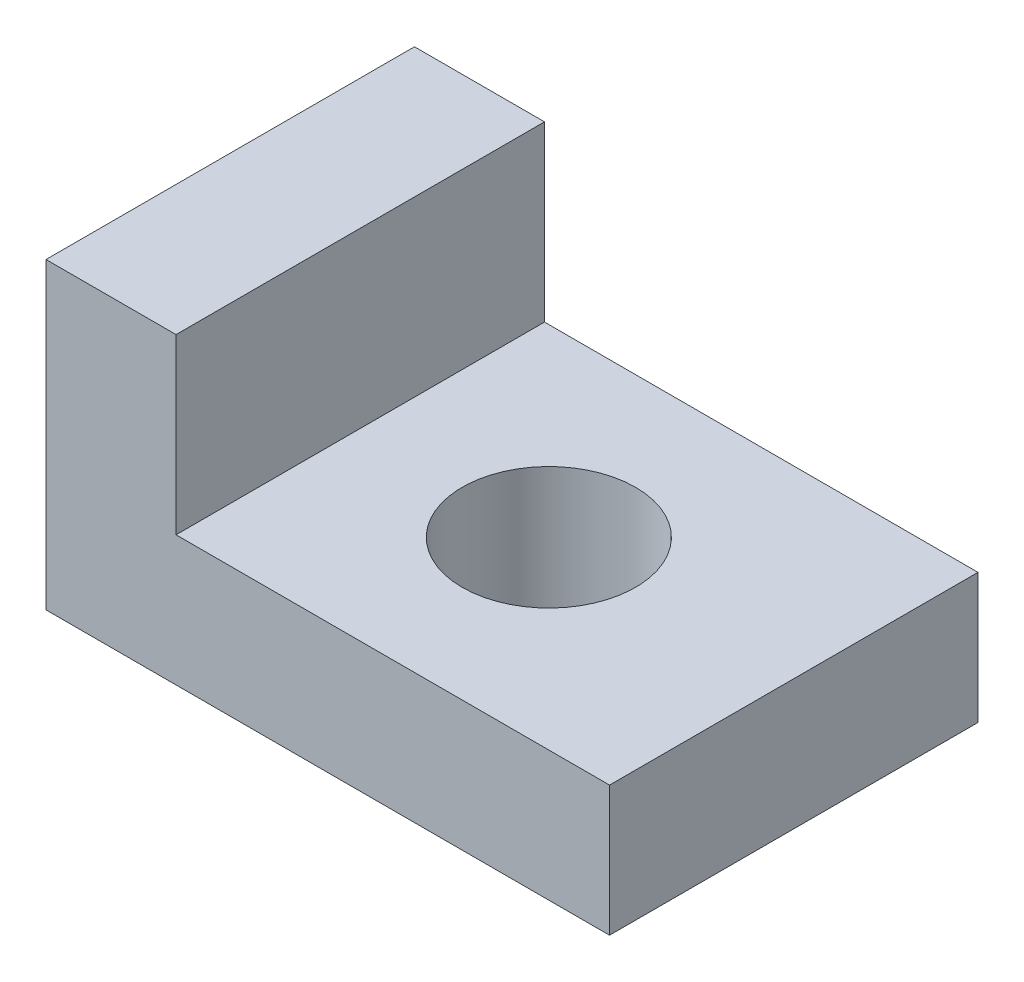
from build123d import *

# Parameters (mm, degrees)
SKETCH1_W           = 13
SKETCH1_H           = 8.5
BOSS_EXTRUDE2_DEPTH = 3
SKETCH2_R           = 2
CUT_EXTRUDE1_DEPTH  = 9.325412903
SKETCH3_W           = 3
SKETCH3_H           = 8.5
BOSS_EXTRUDE3_DEPTH = 4


with BuildPart() as part:
    # Sketch1 → Boss-Extrude2 (new body)
    with BuildSketch(Plane(origin=(0, 0, 0), x_dir=(1, 0, 0), z_dir=(0, 1, 0))):
        Rectangle(SKETCH1_W, SKETCH1_H)
    extrude(amount=BOSS_EXTRUDE2_DEPTH)

    # Sketch2 → Cut-Extrude1 (cut, through all)
    with BuildSketch(Plane(origin=(0, 0, 0), x_dir=(1, 0, 0), z_dir=(0, 1, 0))):
        with Locations(Location((0.85, 0, 0), (0, 0, 270))):
            Circle(SKETCH2_R)
    extrude(amount=CUT_EXTRUDE1_DEPTH, mode=Mode.SUBTRACT)

    # Sketch3 → Boss-Extrude3 (add)
    with BuildSketch(Plane(origin=(0, 3, 0), x_dir=(1, 0, 0), z_dir=(0, 1, 0))):
        with Locations((-5, 0)):
            Rectangle(SKETCH3_W, SKETCH3_H)
    extrude(amount=BOSS_EXTRUDE3_DEPTH)


solid = part.part
